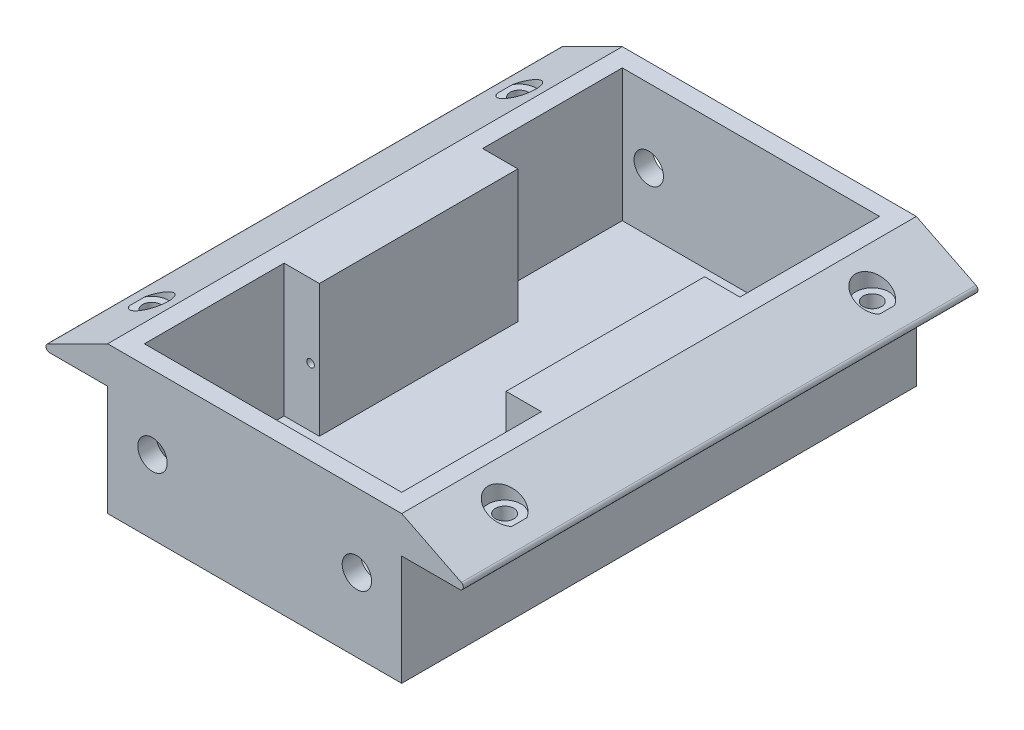
from build123d import *

# Parameters (mm, degrees)
BOSS_EXTRUDE1_DEPTH = 35
CUT_EXTRUDE1_DEPTH  = 18
SKETCH3_R           = 1.25
CUT_EXTRUDE2_DEPTH  = 51.249378106
SKETCH5_R           = 0.518350726
CUT_EXTRUDE5_DEPTH  = 30
FILLET2_R           = 0.5
SKETCH7_R           = 2.25
CUT_EXTRUDE6_DEPTH  = 3
SKETCH8_R           = 2
CUT_EXTRUDE7_DEPTH  = 2.5
CUT_EXTRUDE8_START  = -2.5
SKETCH9_R           = 2
CUT_EXTRUDE8_DEPTH  = 2.5


with BuildPart() as part:
    # Sketch1 → Boss-Extrude1 (new, symmetric)
    with BuildSketch(Plane.XY):
        Polygon((-20, 5), (-20, 10), (-30, 5), align=None)
        Polygon((20, 10), (-20, 10), (-20, 5), (-20, -10), (20, -10), (20, 5), align=None)
        Polygon((30, 5), (20, 10), (20, 5), align=None)
    extrude(amount=BOSS_EXTRUDE1_DEPTH, both=True)

    # Sketch2 → Cut-Extrude1 (cut)
    with BuildSketch(Plane(origin=(0, 10, 0), x_dir=(1, 0, 0), z_dir=(0, 1, 0))):
        Polygon((-17.5, -13.5), (-17.5, -32.5), (17.5, -32.5), (17.5, -13.5), (12.7, -13.5), (12.7, 13.5), (17.5, 13.5), (17.5, 32.5), (-17.5, 32.5), (-17.5, 13.5), (-12.7, 13.5), (-12.7, -13.5), align=None)
    extrude(amount=-CUT_EXTRUDE1_DEPTH, mode=Mode.SUBTRACT)

    # Sketch3 → Cut-Extrude2 (cut, through all)
    with BuildSketch(Plane(origin=(0, 10, 0), x_dir=(1, 0, 0), z_dir=(0, 1, 0))):
        with Locations(Location((-24, 25, 0), (0, 0, 270))):
            Circle(SKETCH3_R)
        with Locations(Location((-24, -25, 0), (0, 0, 270))):
            Circle(SKETCH3_R)
        with Locations((24, 25)):
            Circle(SKETCH3_R)
        with Locations((24, -25)):
            Circle(SKETCH3_R)
    extrude(amount=-CUT_EXTRUDE2_DEPTH, mode=Mode.SUBTRACT)

    # Sketch5 → Cut-Extrude5 (cut, symmetric)
    with BuildSketch(Plane(origin=(0, 0, 0), x_dir=(-1, 0, 0), z_dir=(0, 0, -1))):
        with Locations((-13.9, 0)):
            Circle(SKETCH5_R)
        with Locations((13.9, 0)):
            Circle(SKETCH5_R)
    extrude(amount=CUT_EXTRUDE5_DEPTH, both=True, mode=Mode.SUBTRACT)

    # Fillet2
    fillet2_edges = [part.edges().sort_by_distance(p)[0] for p in [
        (-30, 5, 0),
        (30, 5, 0),
    ]]
    fillet(fillet2_edges, radius=FILLET2_R)

    # Sketch7 → Cut-Extrude6 (cut)
    with BuildSketch(Plane(origin=(0, 10, 0), x_dir=(1, 0, 0), z_dir=(0, 1, 0))):
        with Locations((-24, 25)):
            Circle(SKETCH7_R)
        with Locations((24, 25)):
            Circle(SKETCH7_R)
        with Locations((-24, -25)):
            Circle(SKETCH7_R)
        with Locations((24, -25)):
            Circle(SKETCH7_R)
    extrude(amount=-CUT_EXTRUDE6_DEPTH, mode=Mode.SUBTRACT)

    # Sketch8 → Cut-Extrude7 (cut)
    with BuildSketch(Plane.XY.offset(35)):
        with Locations((-13.9, 0)):
            Circle(SKETCH8_R)
        with Locations((13.9, 0)):
            Circle(SKETCH8_R)
    extrude(amount=-CUT_EXTRUDE7_DEPTH, mode=Mode.SUBTRACT)

    # Sketch9 → Cut-Extrude8 (cut)
    with BuildSketch(Plane(origin=(0, 0, -35), x_dir=(-1, 0, 0), z_dir=(0, 0, -1)).offset(CUT_EXTRUDE8_START)):
        with Locations(Location((13.9, 0, 0), (0, 0, 180))):
            Circle(SKETCH9_R)
        with Locations(Location((-13.9, 0, 0), (0, 0, 180))):
            Circle(SKETCH9_R)
    extrude(amount=CUT_EXTRUDE8_DEPTH, mode=Mode.SUBTRACT)


solid = part.part
